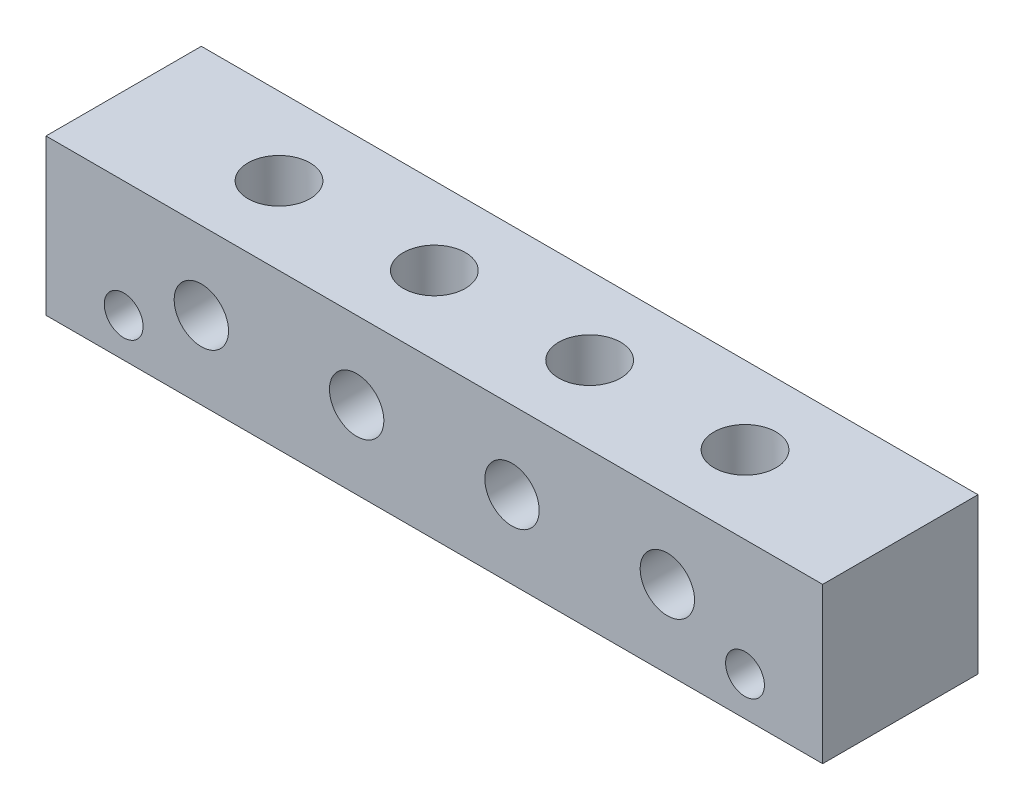
from build123d import *

# Parameters (mm, degrees)
ESQUISSE1_W             = 50
ESQUISSE1_H             = 10
ESQUISSE1_R             = 1.25
ESQUISSE1_R_2           = 1.75
BOSS_EXTRU_1_DEPTH      = 10
ESQUISSE2_R             = 2
ENL_V_MAT_EXTRU_1_DEPTH = 10


with BuildPart() as part:
    # Esquisse1 → Boss.-Extru.1 (new body)
    with BuildSketch(Plane.XY):
        with Locations((25, 5)):
            Rectangle(ESQUISSE1_W, ESQUISSE1_H)
        with Locations((5, 2.5)):
            Circle(ESQUISSE1_R, mode=Mode.SUBTRACT)
        with Locations((45, 2.5)):
            Circle(ESQUISSE1_R, mode=Mode.SUBTRACT)
        with Locations((40, 5)):
            Circle(ESQUISSE1_R_2, mode=Mode.SUBTRACT)
        with Locations((30, 5)):
            Circle(ESQUISSE1_R_2, mode=Mode.SUBTRACT)
        with Locations((20, 5)):
            Circle(ESQUISSE1_R_2, mode=Mode.SUBTRACT)
        with Locations((10, 5)):
            Circle(ESQUISSE1_R_2, mode=Mode.SUBTRACT)
    extrude(amount=BOSS_EXTRU_1_DEPTH)

    # Esquisse2 → Enlèv. mat.-Extru.1 (cut)
    with BuildSketch(Plane.XZ):
        with Locations(Location((40, 5, 0), (0, 0, 270))):
            Circle(ESQUISSE2_R)
        with Locations(Location((30, 5, 0), (0, 0, 270))):
            Circle(ESQUISSE2_R)
        with Locations(Location((20, 5, 0), (0, 0, 270))):
            Circle(ESQUISSE2_R)
        with Locations(Location((10, 5, 0), (0, 0, 270))):
            Circle(ESQUISSE2_R)
    extrude(amount=-ENL_V_MAT_EXTRU_1_DEPTH, mode=Mode.SUBTRACT)


solid = part.part
